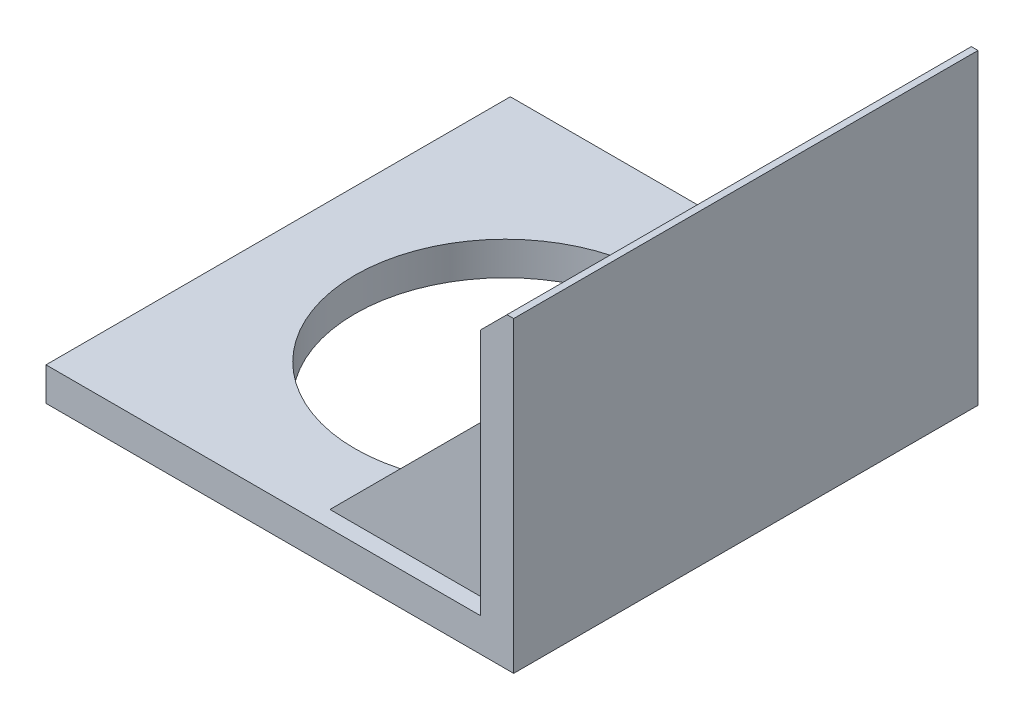
from build123d import *

# Parameters (mm, degrees)
SKETCH1_R       = 45
EXTRUDE1_DEPTH  = 10
SKETCH2_W       = 10
SKETCH2_H       = 139
EXTRUDE2_DEPTH  = 82
CHAMFER1_SIZE   = 8
EXTRUDE3_START  = -5
EXTRUDE3_DEPTH  = 8
LPATTERN1_COUNT = 2
LPATTERN1_PITCH = 121


with BuildPart() as part:
    # Sketch1 → Extrude1 (new body)
    with BuildSketch(Plane(origin=(0, 0, 0), x_dir=(1, 0, 0), z_dir=(0, 1, 0))):
        Polygon((0, 69.5), (-68, 69.5), (-68, -69.5), (0, -69.5), (72, -69.5), (72, 69.5), align=None)
        with Locations(Location((0, 0, 0), (0, 0, 270))):
            Circle(SKETCH1_R, mode=Mode.SUBTRACT)
    extrude(amount=EXTRUDE1_DEPTH)

    # Sketch2 → Extrude2 (add)
    with BuildSketch(Plane(origin=(0, 10, 0), x_dir=(1, 0, 0), z_dir=(0, 1, 0))):
        with Locations((67, 0)):
            Rectangle(SKETCH2_W, SKETCH2_H)
    extrude(amount=EXTRUDE2_DEPTH)

    # Chamfer1
    chamfer1_edges = [part.edges().sort_by_distance(p)[0] for p in [
        (62, 92, 0),
    ]]
    chamfer(chamfer1_edges, length=CHAMFER1_SIZE)

    # Sketch3 → Extrude3 (add)
    with BuildSketch(Plane.XY.offset(69.5).offset(EXTRUDE3_START)):
        Polygon((12, 10), (62, 10), (62, 60), align=None)
    extrude3 = extrude(amount=-EXTRUDE3_DEPTH)

    # LPattern1: Extrude3 ×2
    with Locations(*[(0, 0, -i * LPATTERN1_PITCH) for i in range(1, LPATTERN1_COUNT)]):
        add(extrude3)


solid = part.part
